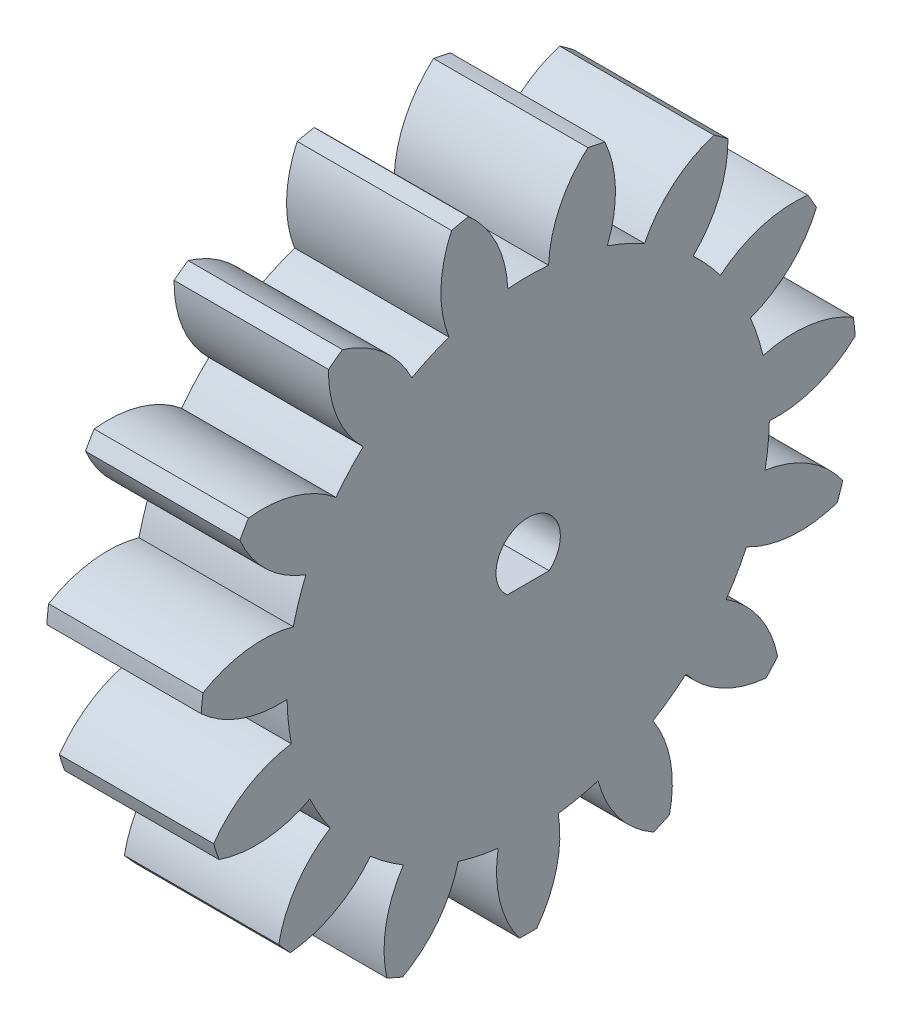
from build123d import *

# Parameters (mm, degrees)
BASPROSKE_W             = 12
BASPROSKE_H             = 25.5
TOOTHCUT_DEPTH          = 39.006578378
TEETHCUTS_COUNT         = 15
TEETHCUTS_ANGLE         = 336
BORSKE_R                = 0.4
BORE_DEPTH              = 50.0000508
CUT_EXTRUDE1_DEPTH      = 38.954121274
CUT_EXTRUDE1_DEPTH_BACK = 38.954121274


with BuildPart() as part:
    # BasProSke → Base-Revolve (revolve)
    with BuildSketch(Plane(origin=(0, 0, 0), x_dir=(1, 0, 0), z_dir=(0, 1, 0)), mode=Mode.PRIVATE) as base_revolve_sk:
        with Locations((6, 12.75)):
            Rectangle(BASPROSKE_W, BASPROSKE_H)
    revolve(base_revolve_sk.sketch.rotate(Axis((-10, 0, 0), (1, 0, 0)), 180), axis=Axis((-10, 0, 0), (1, 0, 0)))

    # TooCutSke → ToothCut (cut, through all)
    with BuildSketch(Plane(origin=(0, 0, 0), x_dir=(0, 0, -1), z_dir=(1, 0, 0))):
        with BuildLine():
            ThreePointArc((1.584594428, 18.681918036), (0, 18.749), (-1.584594428, 18.681918036))
            ThreePointArc((-1.584594428, 18.681918036), (-2.465052499, 22.206073835), (-4.666912141, 25.095138498))
            ThreePointArc((-4.666912141, 25.095138498), (0, 25.5254), (4.666912141, 25.095138498))
            ThreePointArc((4.666912141, 25.095138498), (2.465052499, 22.206073835), (1.584594428, 18.681918036))
        make_face()
    toothcut = extrude(amount=TOOTHCUT_DEPTH, mode=Mode.SUBTRACT)

    # TeethCuts: ToothCut ×15 about axis
    teethcuts_axis = Axis((-10, 0, 0), (1, 0, 0))
    for i in range(1, TEETHCUTS_COUNT):
        add(toothcut.rotate(teethcuts_axis, i * TEETHCUTS_ANGLE / (TEETHCUTS_COUNT - 1)), mode=Mode.SUBTRACT)

    # BorSke → Bore (cut, symmetric)
    with BuildSketch(Plane(origin=(0, 0, 0), x_dir=(0, 0, -1), z_dir=(1, 0, 0))):
        with Locations(Location((0, 0, 0), (0, 0, 180))):
            Circle(BORSKE_R)
    extrude(amount=BORE_DEPTH, both=True, mode=Mode.SUBTRACT)

    # Sketch1 → Cut-Extrude1 (cut, two sides: drawn at the far end of the back side and taken through both)
    with BuildSketch(Plane(origin=(12, 0, 0), x_dir=(0, 0, -1), z_dir=(1, 0, 0)).offset(-CUT_EXTRUDE1_DEPTH_BACK)):
        with BuildLine():
            ThreePointArc((2.5, 0), (-1.045939959, 2.270684831), (-1.624807681, -1.9))
            Line((-1.624807681, -1.9), (1.624807681, -1.9))
            ThreePointArc((1.624807681, -1.9), (2.270684831, -1.045939959), (2.5, 0))
        make_face()
    extrude(amount=CUT_EXTRUDE1_DEPTH + CUT_EXTRUDE1_DEPTH_BACK, mode=Mode.SUBTRACT)


solid = part.part
